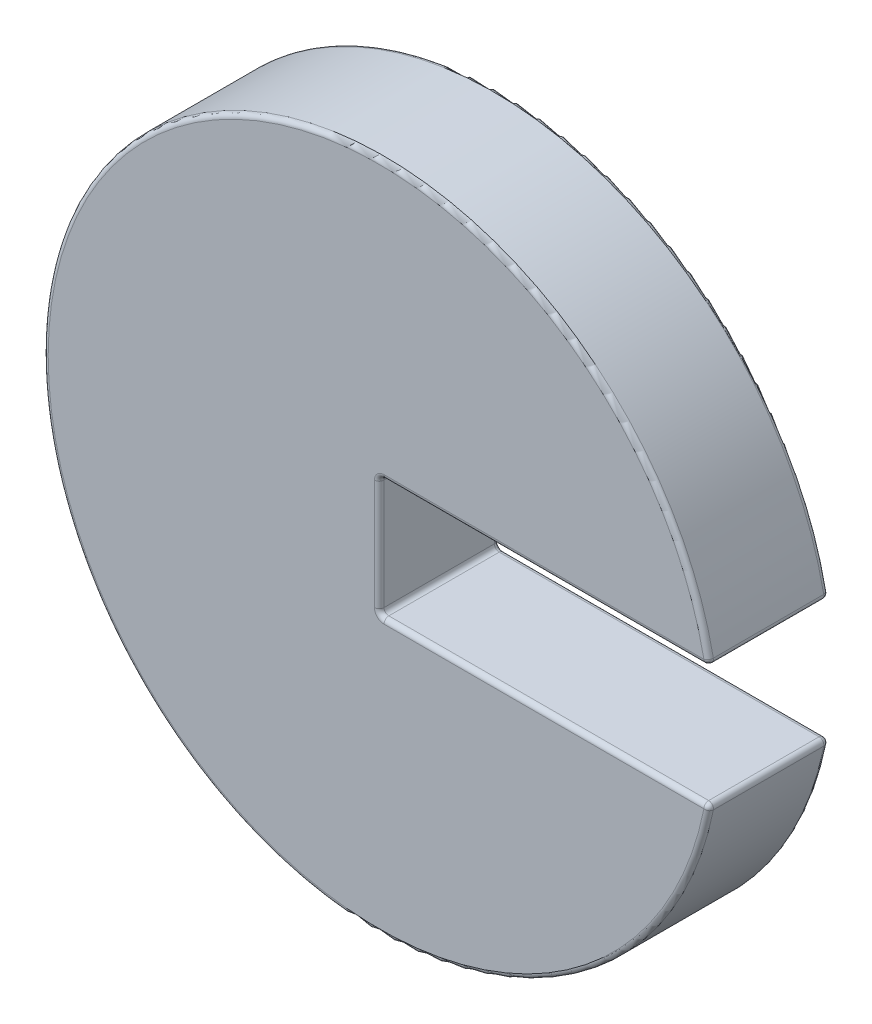
from build123d import *

# Parameters (mm, degrees)
RESSALTO_EXTRUS_O1_DEPTH = 2.5
FILETE1_R                = 0.1


with BuildPart() as part:
    # Esboço1 → Ressalto-extrusão1 (new body)
    with BuildSketch(Plane.XY):
        with BuildLine():
            Line((-88.734374253, 18.21347197), (-88.734374253, 20.71347197))
            Line((-88.734374253, 20.71347197), (-81.846885596, 20.71347197))
            ThreePointArc((-81.846885596, 20.71347197), (-95.734374253, 19.46347197), (-81.846885596, 18.21347197))
            Line((-81.846885596, 18.21347197), (-88.734374253, 18.21347197))
        make_face()
    extrude(amount=RESSALTO_EXTRUS_O1_DEPTH)

    # Filete1
    filete1_edges = [part.edges().sort_by_distance(p)[0] for p in [
        (-85.290629924, 18.21347197, 2.5),
        (-88.734374253, 19.46347197, 2.5),
        (-85.290629924, 20.71347197, 2.5),
        (-88.734374253, 19.46347197, 0),
        (-85.290629924, 18.21347197, 0),
        (-95.734374253, 19.46347197, 0),
        (-85.290629924, 20.71347197, 0),
        (-88.734374253, 20.71347197, 1.25),
        (-88.734374253, 18.21347197, 1.25),
        (-81.846885596, 18.21347197, 1.25),
        (-81.846885596, 20.71347197, 1.25),
        (-95.734374253, 19.46347197, 2.5),
    ]]
    fillet(filete1_edges, radius=FILETE1_R)


solid = part.part
